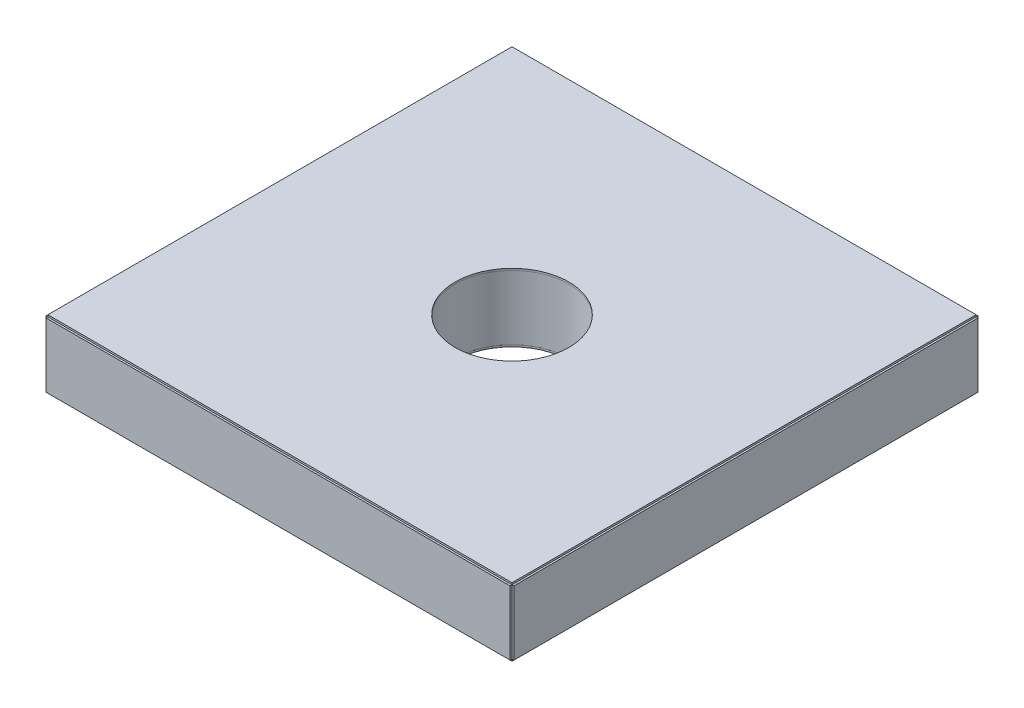
from build123d import *

# Parameters (mm, degrees)
SKETCH1_W           = 641.1
SKETCH1_H           = 641.1
BOSS_EXTRUDE1_DEPTH = 2.54
SKETCH2_W           = 641.1
SKETCH2_H           = 641.1
BOSS_EXTRUDE2_DEPTH = 88.9
SKETCH3_W           = 641.1
SKETCH3_H           = 88.9
BOSS_EXTRUDE3_DEPTH = 2.54
CIRPATTERN1_COUNT   = 4
SKETCH5_R           = 78.5
CUT_EXTRUDE1_DEPTH  = 915.825760897
SKETCH7_W           = 641.1
SKETCH7_H           = 641.1
SKETCH7_R           = 78.5
BOSS_EXTRUDE4_DEPTH = 2.54


with BuildPart() as part:
    # Sketch1 → Boss-Extrude1 (new body)
    with BuildSketch(Plane(origin=(0, 0, 0), x_dir=(1, 0, 0), z_dir=(0, 1, 0))):
        with Locations((320.55, 320.55)):
            Rectangle(SKETCH1_W, SKETCH1_H)
    extrude(amount=BOSS_EXTRUDE1_DEPTH)


with BuildPart() as body_2:
    # Sketch2 → Boss-Extrude2 (new body)
    with BuildSketch(Plane(origin=(0, 2.54, 0), x_dir=(1, 0, 0), z_dir=(0, 1, 0))):
        with Locations((320.55, 320.55)):
            Rectangle(SKETCH2_W, SKETCH2_H)
    extrude(amount=BOSS_EXTRUDE2_DEPTH)


with BuildPart() as body_3:
    # Sketch3 → Boss-Extrude3 (new body)
    with BuildSketch(Plane.XY):
        with Locations((320.55, 46.99)):
            Rectangle(SKETCH3_W, SKETCH3_H)
    extrude(amount=BOSS_EXTRUDE3_DEPTH)


with BuildPart() as cirpattern1_1:
    # CirPattern1: pattern copy
    add(body_3.part.rotate(Axis((320.55, 91.44, -320.55), (0, 1, 0)), 1 * 360 / CIRPATTERN1_COUNT))


with BuildPart() as cirpattern1_2:
    # CirPattern1: pattern copy
    add(body_3.part.rotate(Axis((320.55, 91.44, -320.55), (0, 1, 0)), 2 * 360 / CIRPATTERN1_COUNT))


with BuildPart() as cirpattern1_3:
    # CirPattern1: pattern copy
    add(body_3.part.rotate(Axis((320.55, 91.44, -320.55), (0, 1, 0)), 3 * 360 / CIRPATTERN1_COUNT))


with BuildPart() as cut_extrude1_tool:
    # Sketch5 → Cut-Extrude1 (new, through all)
    with BuildSketch(Plane(origin=(0, 91.44, 0), x_dir=(1, 0, 0), z_dir=(0, 1, 0))):
        with Locations((320.55, 320.55)):
            Circle(SKETCH5_R)
    extrude(amount=-CUT_EXTRUDE1_DEPTH)


with BuildPart() as part_1:
    add(part.part)

    # Cut-Extrude1: cut by cut_extrude1_tool
    add(cut_extrude1_tool.part, mode=Mode.SUBTRACT)


with BuildPart() as body_2_1:
    add(body_2.part)

    # Cut-Extrude1: cut by cut_extrude1_tool
    add(cut_extrude1_tool.part, mode=Mode.SUBTRACT)


with BuildPart() as body_7:
    # Sketch7 → Boss-Extrude4 (new body)
    with BuildSketch(Plane(origin=(0, 91.44, 0), x_dir=(1, 0, 0), z_dir=(0, 1, 0))):
        with Locations((320.55, 320.55)):
            Rectangle(SKETCH7_W, SKETCH7_H)
        with Locations((320.55, 320.55)):
            Circle(SKETCH7_R, mode=Mode.SUBTRACT)
    extrude(amount=BOSS_EXTRUDE4_DEPTH)


solid = Compound([body_3.part, cirpattern1_1.part, cirpattern1_2.part, cirpattern1_3.part, part_1.part, body_2_1.part, body_7.part])
